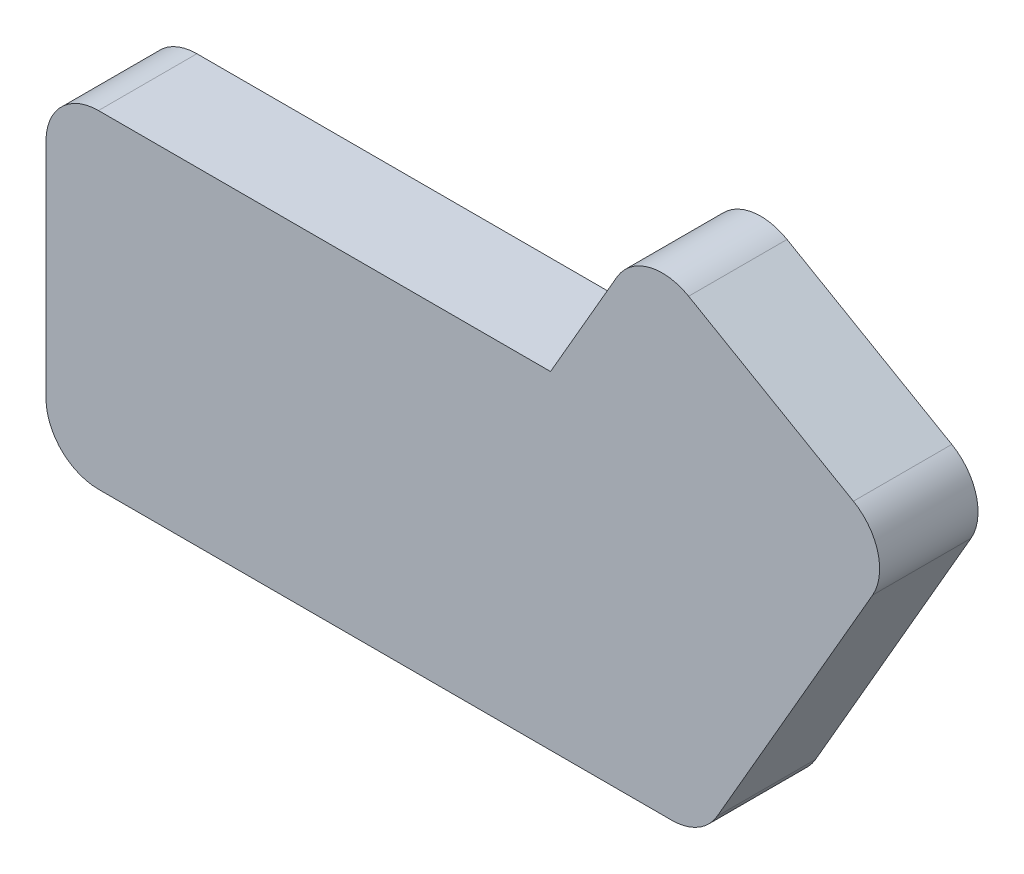
from build123d import *

# Parameters (mm, degrees)
BOSS_EXTRUDE1_DEPTH = 15


with BuildPart() as part:
    # Sketch1 → Boss-Extrude1 (new body)
    with BuildSketch(Plane.XY):
        with BuildLine():
            Line((8, 0), (95.381197846, 0))
            ThreePointArc((95.381197846, 0), (99.381197846, 1.07179677), (102.309401077, 4))
            Line((102.309401077, 4), (126, 45.033320997))
            ThreePointArc((126, 45.033320997), (126.79920338, 51.103873358), (123.07179677, 55.961524227))
            Line((123.07179677, 55.961524227), (97.95706006, 70.461524227))
            ThreePointArc((97.95706006, 70.461524227), (91.886507699, 71.260727607), (87.02885683, 67.533320997))
            Line((87.02885683, 67.533320997), (76.905989232, 50))
            Line((76.905989232, 50), (8, 50))
            ThreePointArc((8, 50), (2.343145751, 47.656854249), (0, 42))
            Line((0, 42), (0, 8))
            ThreePointArc((0, 8), (2.343145751, 2.343145751), (8, 0))
        make_face()
    extrude(amount=BOSS_EXTRUDE1_DEPTH)


solid = part.part
